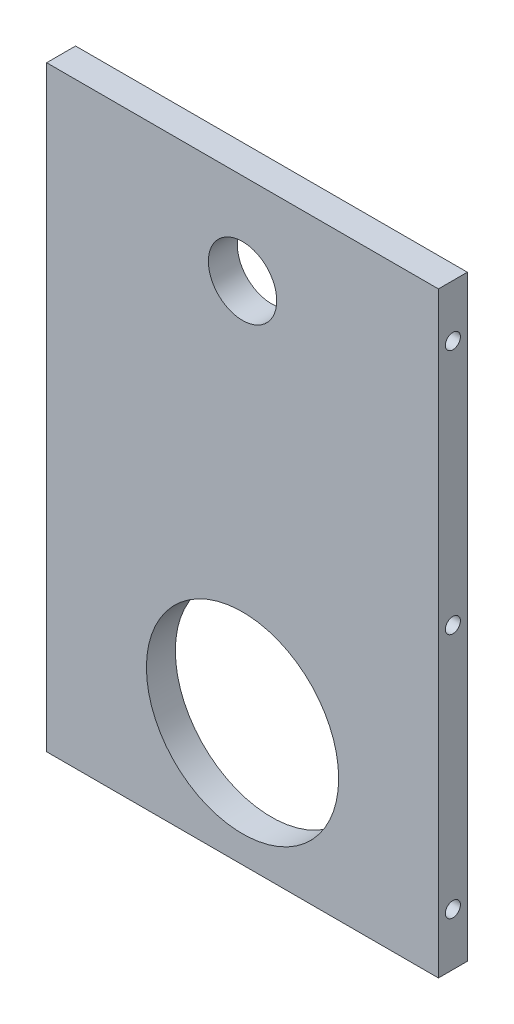
from build123d import *

# Parameters (mm, degrees)
SKETCH1_W           = 86
SKETCH1_H           = 131
BOSS_EXTRUDE1_DEPTH = 3.175
SKETCH2_R           = 1.65
CUT_EXTRUDE1_DEPTH  = 10
SKETCH3_R           = 7.5
CUT_EXTRUDE2_DEPTH  = 79.610256964
SKETCH4_R           = 21.1
CUT_EXTRUDE3_DEPTH  = 79.610256964


with BuildPart() as part:
    # Sketch1 → Boss-Extrude1 (new, symmetric)
    with BuildSketch(Plane.XY):
        Rectangle(SKETCH1_W, SKETCH1_H)
    extrude(amount=BOSS_EXTRUDE1_DEPTH, both=True)

    # Sketch2 → Cut-Extrude1 (cut)
    with BuildSketch(Plane.ZY.offset(43)):
        with Locations((0, 54)):
            Circle(SKETCH2_R)
        with Locations((0, -54)):
            Circle(SKETCH2_R)
        Circle(SKETCH2_R)
    cut_extrude1 = extrude(amount=-CUT_EXTRUDE1_DEPTH, mode=Mode.SUBTRACT)

    # Mirror1: Cut-Extrude1 across plane
    add(cut_extrude1.mirror(Plane(origin=(0, 0, 0), x_dir=(0, 0, 1), z_dir=(1, 0, 0))), mode=Mode.SUBTRACT)

    # Sketch3 → Cut-Extrude2 (cut, through all)
    with BuildSketch(Plane.XY.offset(3.175)):
        with Locations((0, 45.5)):
            Circle(SKETCH3_R)
    extrude(amount=-CUT_EXTRUDE2_DEPTH, mode=Mode.SUBTRACT)

    # Sketch4 → Cut-Extrude3 (cut, through all)
    with BuildSketch(Plane.XY.offset(3.175)):
        with Locations((0, -38.5)):
            Circle(SKETCH4_R)
    extrude(amount=-CUT_EXTRUDE3_DEPTH, mode=Mode.SUBTRACT)


solid = part.part
